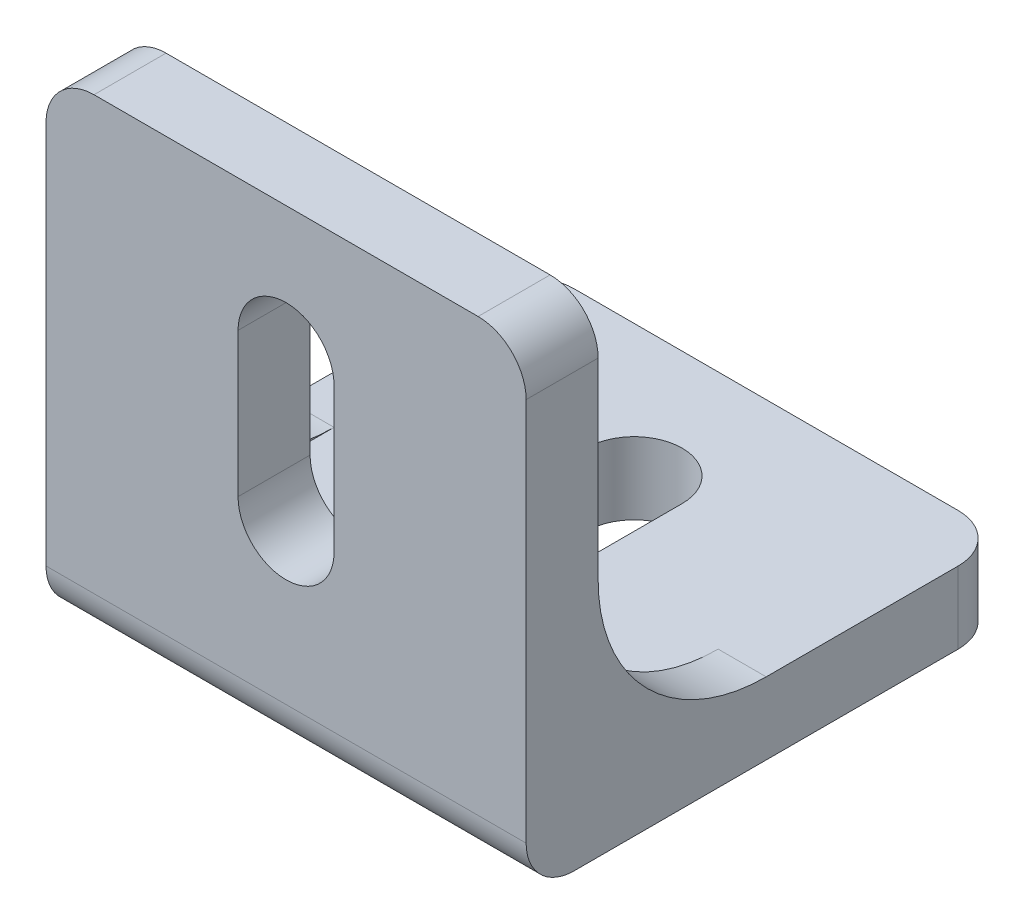
from build123d import *

# Parameters (mm, degrees)
EXTRUDE_1_DEPTH     = 20
FILLET_1_R          = 2
SKETCH_2_W          = 7
SKETCH_2_H          = 7
CUT_EXTRUDE_1_DEPTH = 8
CUT_EXTRUDE_4_DEPTH = 29.08914381
CUT_EXTRUDE_5_DEPTH = 29.08914381


with BuildPart() as part:
    # 草图1 → 凸台-拉伸1 (new body)
    with BuildSketch(Plane(origin=(0, 0, 0), x_dir=(0, 0, -1), z_dir=(1, 0, 0))):
        with BuildLine():
            Line((-7, 10), (-7, 0))
            ThreePointArc((-7, 0), (-4.949747468, -4.949747468), (0, -7))
            Line((0, -7), (10, -7))
            Line((10, -7), (10, -10))
            Line((10, -10), (-10, -10))
            Line((-10, -10), (-10, 10))
            Line((-10, 10), (-7, 10))
        make_face()
    extrude(amount=-EXTRUDE_1_DEPTH)

    # 圆角1
    fillet_1_edges = [part.edges().sort_by_distance(p)[0] for p in [
        (-10, -10, 10),
        (-20, -8.5, -10),
        (0, -8.5, -10),
        (-20, 10, 8.5),
        (0, 10, 8.5),
    ]]
    fillet(fillet_1_edges, radius=FILLET_1_R)

    # 草图2 → 切除-拉伸1 (cut, symmetric)
    with BuildSketch(Plane.ZY.offset(10)):
        with Locations((3.5, -3.5)):
            Rectangle(SKETCH_2_W, SKETCH_2_H)
    extrude(amount=CUT_EXTRUDE_1_DEPTH, both=True, mode=Mode.SUBTRACT)

    # 草图3 → 切除-拉伸4 (cut, through all)
    with BuildSketch(Plane(origin=(0, -7, 0), x_dir=(1, 0, 0), z_dir=(0, 1, 0))):
        with BuildLine():
            Line((-12, 4.5), (-12, -1.5))
            ThreePointArc((-12, -1.5), (-10, -3.5), (-8, -1.5))
            Line((-8, -1.5), (-8, 4.5))
            ThreePointArc((-8, 4.5), (-10, 6.5), (-12, 4.5))
        make_face()
    extrude(amount=-CUT_EXTRUDE_4_DEPTH, mode=Mode.SUBTRACT)

    # 草图6 → 切除-拉伸5 (cut, through all)
    with BuildSketch(Plane(origin=(0, 0, 7), x_dir=(-1, 0, 0), z_dir=(0, 0, -1))):
        with BuildLine():
            Line((8, 4.5), (8, -1.5))
            ThreePointArc((8, -1.5), (10, -3.5), (12, -1.5))
            Line((12, -1.5), (12, 4.5))
            ThreePointArc((12, 4.5), (10, 6.5), (8, 4.5))
        make_face()
    extrude(amount=-CUT_EXTRUDE_5_DEPTH, mode=Mode.SUBTRACT)


solid = part.part
